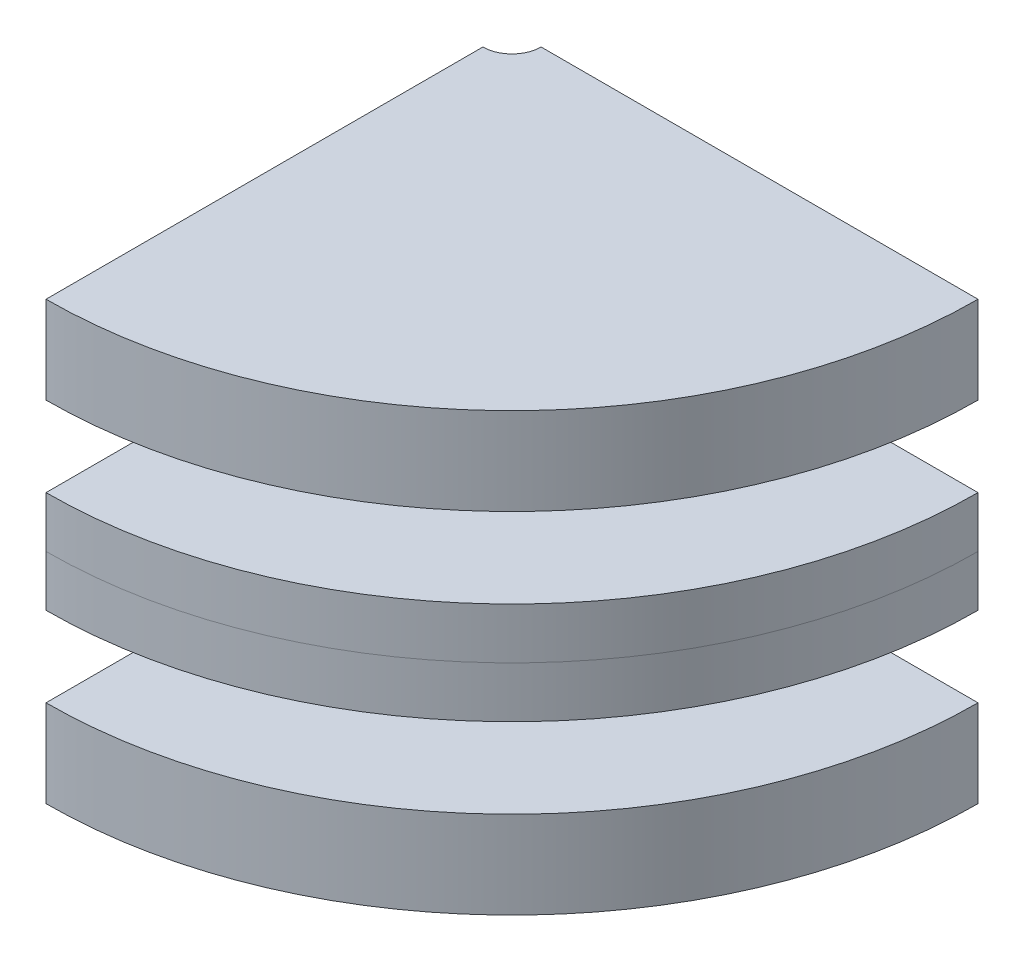
from build123d import *

# Parameters (mm, degrees)
BOSS_EXTRUDE1_DEPTH = 3
BOSS_EXTRUDE2_DEPTH = 1.75


with BuildPart() as part:
    # Sketch1 → Boss-Extrude1 (new body)
    with BuildSketch(Plane(origin=(0, 0, 0), x_dir=(1, 0, 0), z_dir=(0, 1, 0))):
        with BuildLine():
            Line((0, 0), (0, 15))
            ThreePointArc((0, 15), (0.707106781, 15.292893219), (1, 16))
            Line((1, 16), (16, 16))
            ThreePointArc((16, 16), (11.313708499, 4.686291501), (0, 0))
        make_face()
    extrude(amount=BOSS_EXTRUDE1_DEPTH)


with BuildPart() as body_2:
    # Sketch2 → Boss-Extrude2 (new body)
    with BuildSketch(Plane(origin=(0, 5.75, 0), x_dir=(1, 0, 0), z_dir=(0, 1, 0))):
        with BuildLine():
            Line((1, 16), (16, 16))
            ThreePointArc((16, 16), (11.313708499, 4.686291501), (0, 0))
            Line((0, 0), (0, 15))
            ThreePointArc((0, 15), (0.707106781, 15.292893219), (1, 16))
        make_face()
    extrude(amount=BOSS_EXTRUDE2_DEPTH)


with BuildPart() as body_3:
    # Mirror1: mirrored copy
    add(part.part.mirror(Plane(origin=(0, 7.5, -16), x_dir=(0, 0, 1), z_dir=(0, 1, 0))))


with BuildPart() as body_4:
    # Mirror1 2: mirrored copy
    add(body_2.part.mirror(Plane(origin=(0, 7.5, -16), x_dir=(0, 0, 1), z_dir=(0, 1, 0))))


solid = Compound([part.part, body_2.part, body_3.part, body_4.part])
